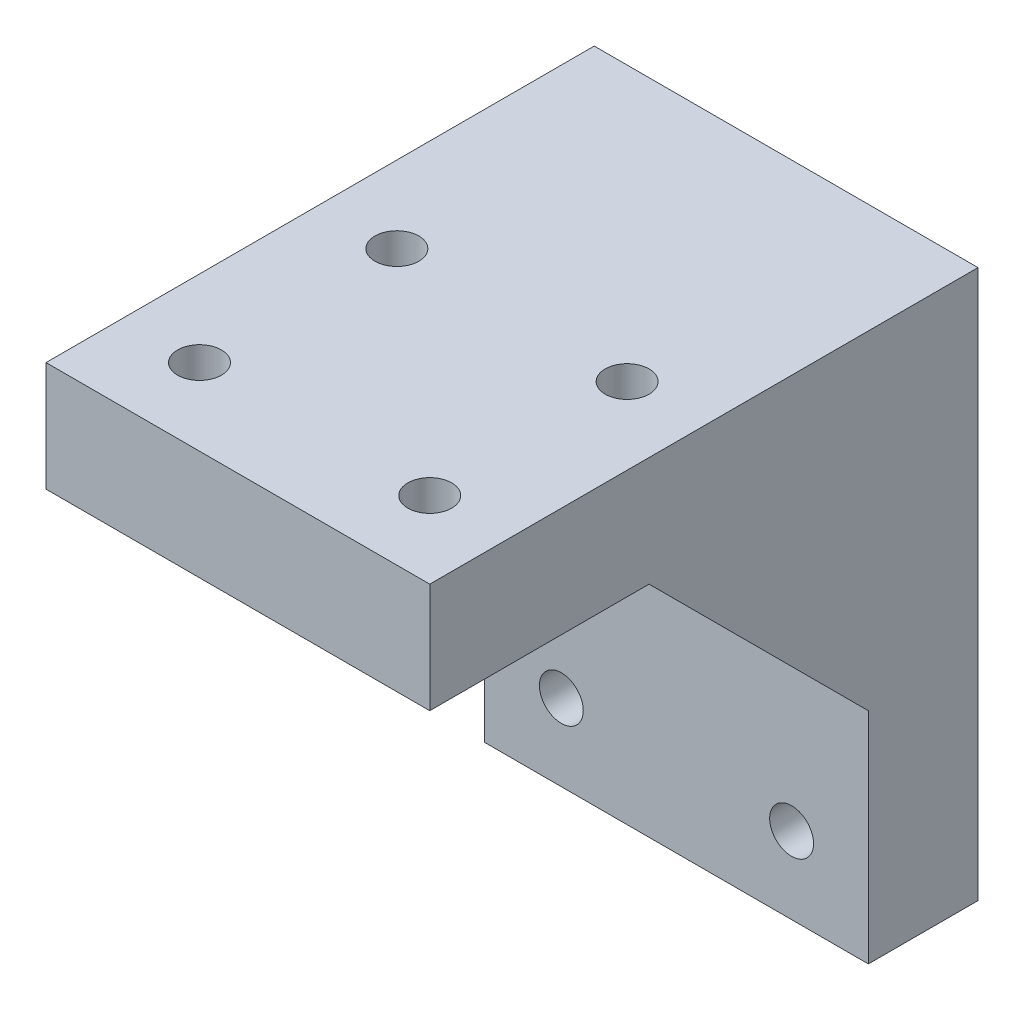
from build123d import *

# Parameters (mm, degrees)
SKETCH1_W           = 35
SKETCH1_H           = 50
BOSS_EXTRUDE1_DEPTH = 10
SKETCH2_W           = 35
SKETCH2_H           = 10
BOSS_EXTRUDE2_DEPTH = 40
SKETCH3_R           = 2
CUT_EXTRUDE1_DEPTH  = 30
SKETCH4_R           = 2
CUT_EXTRUDE2_DEPTH  = 30
BOSS_EXTRUDE3_DEPTH = 35
SKETCH6_R           = 3.5
CUT_EXTRUDE3_DEPTH  = 30
SKETCH7_R           = 3.5
CUT_EXTRUDE4_DEPTH  = 30


with BuildPart() as part:
    # Sketch1 → Boss-Extrude1 (new body)
    with BuildSketch(Plane.XY):
        with Locations((-5.304878049, 18.567073171)):
            Rectangle(SKETCH1_W, SKETCH1_H)
    extrude(amount=BOSS_EXTRUDE1_DEPTH)

    # Sketch2 → Boss-Extrude2 (add)
    with BuildSketch(Plane.XY.offset(10)):
        with Locations((-5.304878049, 38.567073171)):
            Rectangle(SKETCH2_W, SKETCH2_H)
    extrude(amount=BOSS_EXTRUDE2_DEPTH)

    # Sketch3 → Cut-Extrude1 (cut)
    with BuildSketch(Plane.XY.offset(10)):
        with Locations((5.195121951, 0.567073171)):
            Circle(SKETCH3_R)
        with Locations((-15.804878049, 18.567073171)):
            Circle(SKETCH3_R)
        with Locations((5.195121951, 18.567073171)):
            Circle(SKETCH3_R)
        with Locations((-15.804878049, 0.567073171)):
            Circle(SKETCH3_R)
    extrude(amount=-CUT_EXTRUDE1_DEPTH, mode=Mode.SUBTRACT)

    # Sketch4 → Cut-Extrude2 (cut)
    with BuildSketch(Plane.XZ.offset(-33.567073171)):
        with Locations(Location((-15.804878049, 43, 0), (0, 0, 270))):
            Circle(SKETCH4_R)
        with Locations(Location((5.195121951, 43, 0), (0, 0, 270))):
            Circle(SKETCH4_R)
        with Locations(Location((-15.804878049, 25, 0), (0, 0, 270))):
            Circle(SKETCH4_R)
        with Locations(Location((5.195121951, 25, 0), (0, 0, 270))):
            Circle(SKETCH4_R)
    extrude(amount=-CUT_EXTRUDE2_DEPTH, mode=Mode.SUBTRACT)

    # Sketch5 → Boss-Extrude3 (add)
    with BuildSketch(Plane.ZY.offset(22.804878049)):
        Polygon((30, 33.567073171), (10, 13.567073171), (10, 33.567073171), align=None)
    extrude(amount=-BOSS_EXTRUDE3_DEPTH)

    # Sketch6 → Cut-Extrude3 (cut)
    with BuildSketch(Plane(origin=(0, 33.567073171, 0), x_dir=(1, 0, 0), z_dir=(0, 1, 0))):
        with Locations(Location((5.195121951, -25, 0), (0, 0, 180))):
            Circle(SKETCH6_R)
        with Locations(Location((-15.804878049, -25, 0), (0, 0, 180))):
            Circle(SKETCH6_R)
    extrude(amount=-CUT_EXTRUDE3_DEPTH, mode=Mode.SUBTRACT)

    # Sketch7 → Cut-Extrude4 (cut)
    with BuildSketch(Plane(origin=(0, 0, 10), x_dir=(-1, 0, 0), z_dir=(0, 0, -1))):
        with Locations((-5.195121951, 18.567073171)):
            Circle(SKETCH7_R)
        with Locations((15.804878049, 18.567073171)):
            Circle(SKETCH7_R)
    extrude(amount=-CUT_EXTRUDE4_DEPTH, mode=Mode.SUBTRACT)


solid = part.part
